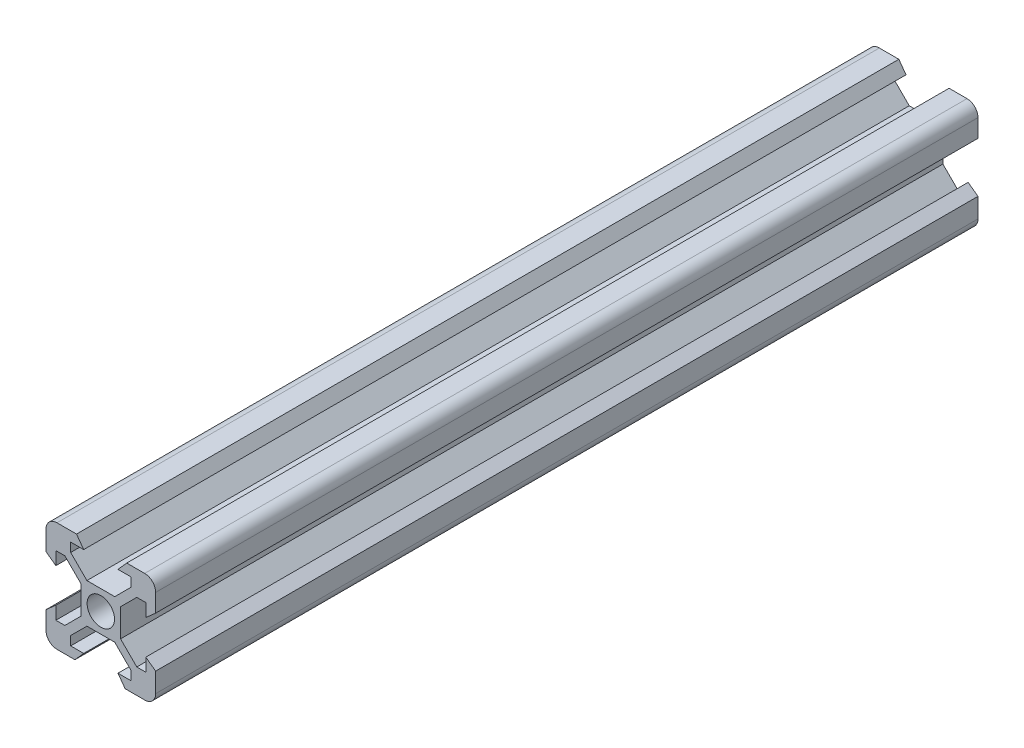
from build123d import *

# Parameters (mm, degrees)
SKETCH1_R               = 2.5
ALUMINIUM_PROFILE_DEPTH = 150


with BuildPart() as part:
    # Sketch1 → Aluminium_profile (new body)
    with BuildSketch(Plane.XY):
        with BuildLine():
            Line((-4.725542729, -10), (-3.125, -8.2))
            Line((-3.125, -8.2), (-5.5, -8.2))
            Line((-5.5, -8.2), (-5.5, -6.560660172))
            Line((-5.5, -6.560660172), (-2.539339828, -3.6))
            Line((-2.539339828, -3.6), (2.539339828, -3.6))
            Line((2.539339828, -3.6), (5.5, -6.560660172))
            Line((5.5, -6.560660172), (5.5, -8.2))
            Line((5.5, -8.2), (3.125, -8.2))
            Line((3.125, -8.2), (4.434457271, -10))
            Line((4.434457271, -10), (8, -10))
            ThreePointArc((8, -10), (9.414213562, -9.414213562), (10, -8))
            Line((10, -8), (10, -4.434457271))
            Line((10, -4.434457271), (8.2, -3.125))
            Line((8.2, -3.125), (8.2, -5.5))
            Line((8.2, -5.5), (6.560660172, -5.5))
            Line((6.560660172, -5.5), (3.6, -2.539339828))
            Line((3.6, -2.539339828), (3.6, 2.539339828))
            Line((3.6, 2.539339828), (6.560660172, 5.5))
            Line((6.560660172, 5.5), (8.2, 5.5))
            Line((8.2, 5.5), (8.2, 3.125))
            Line((8.2, 3.125), (10, 4.725542729))
            Line((10, 4.725542729), (10, 8))
            ThreePointArc((10, 8), (9.414213562, 9.414213562), (8, 10))
            Line((8, 10), (4.725542729, 10))
            Line((4.725542729, 10), (3.125, 8.2))
            Line((3.125, 8.2), (5.5, 8.2))
            Line((5.5, 8.2), (5.5, 6.560660172))
            Line((5.5, 6.560660172), (2.539339828, 3.6))
            Line((2.539339828, 3.6), (-2.539339828, 3.6))
            Line((-2.539339828, 3.6), (-5.5, 6.560660172))
            Line((-5.5, 6.560660172), (-5.5, 8.2))
            Line((-5.5, 8.2), (-3.125, 8.2))
            Line((-3.125, 8.2), (-4.434457271, 10))
            Line((-4.434457271, 10), (-8, 10))
            ThreePointArc((-8, 10), (-9.414213562, 9.414213562), (-10, 8))
            Line((-10, 8), (-10, 4.434457271))
            Line((-10, 4.434457271), (-8.2, 3.125))
            Line((-8.2, 3.125), (-8.2, 5.5))
            Line((-8.2, 5.5), (-6.560660172, 5.5))
            Line((-6.560660172, 5.5), (-3.6, 2.539339828))
            Line((-3.6, 2.539339828), (-3.6, -2.539339828))
            Line((-3.6, -2.539339828), (-6.560660172, -5.5))
            Line((-6.560660172, -5.5), (-8.2, -5.5))
            Line((-8.2, -5.5), (-8.2, -3.125))
            Line((-8.2, -3.125), (-10, -4.725542729))
            Line((-10, -4.725542729), (-10, -8))
            ThreePointArc((-10, -8), (-9.414213562, -9.414213562), (-8, -10))
            Line((-8, -10), (-4.725542729, -10))
        make_face()
        Circle(SKETCH1_R, mode=Mode.SUBTRACT)
    extrude(amount=ALUMINIUM_PROFILE_DEPTH)


solid = part.part
